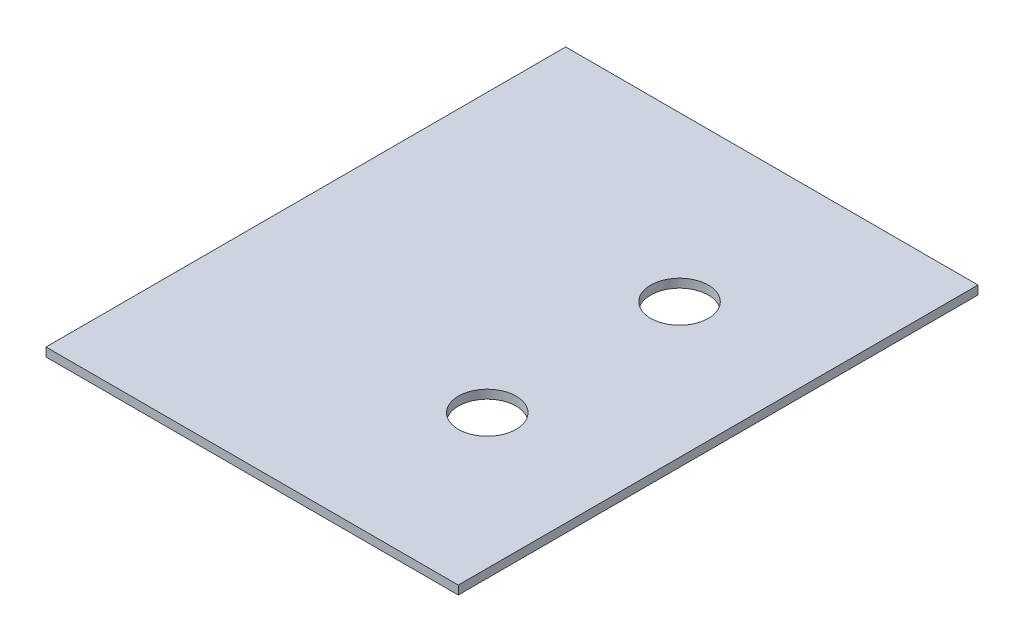
from build123d import *

# Parameters (mm, degrees)
SKETCH1_W           = 23.8
SKETCH1_H           = 30
BOSS_EXTRUDE1_DEPTH = 0.5
CUT_EXTRUDE1_REACH  = 21.154
SKETCH2_R           = 1.665


with BuildPart() as part:
    # Sketch1 → Boss-Extrude1 (new body)
    with BuildSketch(Plane(origin=(0, 0, 0), x_dir=(1, 0, 0), z_dir=(0, 1, 0))):
        Rectangle(SKETCH1_W, SKETCH1_H)
    extrude(amount=BOSS_EXTRUDE1_DEPTH)

    # Sketch2 → Cut-Extrude1 (cut, up to next)
    with BuildSketch(Plane(origin=(0, 0.5, 0), x_dir=(1, 0, 0), z_dir=(0, 1, 0)), mode=Mode.PRIVATE) as cut_extrude1_sk1:
        with Locations(Location((4.121380866, 5.549386368, 0), (0, 0, 270))):
            Circle(SKETCH2_R)
    cut_extrude1_tool1 = extrude(cut_extrude1_sk1.sketch, amount=-CUT_EXTRUDE1_REACH, mode=Mode.PRIVATE) & part.part
    # Sketch2 → Cut-Extrude1 (cut, up to next)
    with BuildSketch(Plane(origin=(0, 0.5, 0), x_dir=(1, 0, 0), z_dir=(0, 1, 0)), mode=Mode.PRIVATE) as cut_extrude1_sk2:
        with Locations(Location((4.121380866, -5.55, 0), (0, 0, 270))):
            Circle(SKETCH2_R)
    cut_extrude1_tool2 = extrude(cut_extrude1_sk2.sketch, amount=-CUT_EXTRUDE1_REACH, mode=Mode.PRIVATE) & part.part
    add(cut_extrude1_tool1.solids().sort_by_distance((4.121381, 0.5, -5.549386))[0], mode=Mode.SUBTRACT)
    add(cut_extrude1_tool2.solids().sort_by_distance((4.121381, 0.5, 5.55))[0], mode=Mode.SUBTRACT)


solid = part.part
